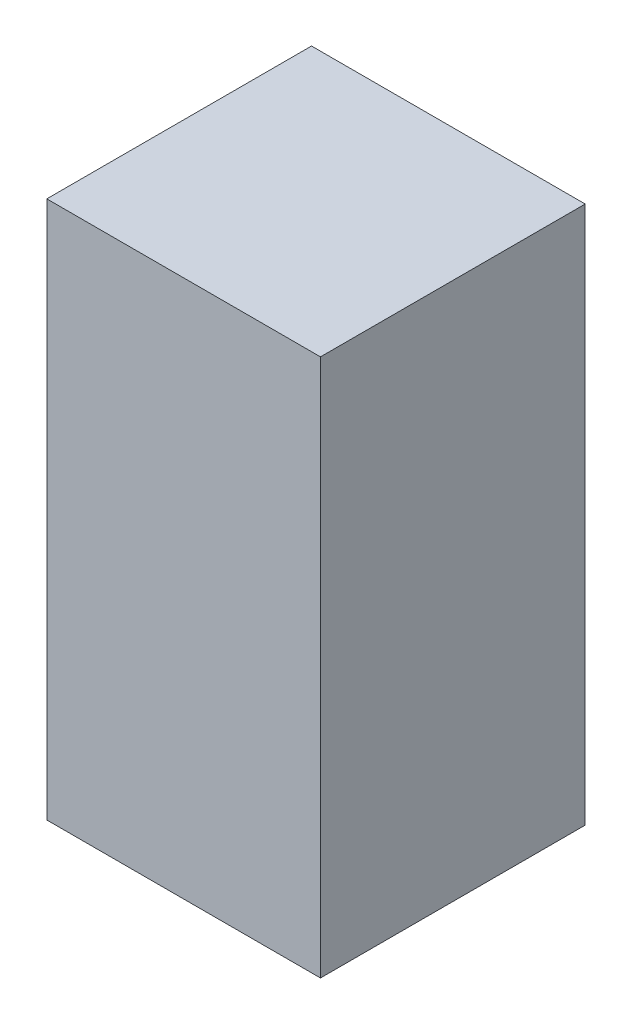
from build123d import *

# Parameters (mm, degrees)
SKETCH1_W               = 10.3378
SKETCH1_H               = 20.32
COMPONENT_OUTLINE_DEPTH = 10


with BuildPart() as part:
    # Sketch1 → Component_Outline (new body)
    with BuildSketch(Plane.XY):
        with Locations((-3.8481, 8.5598)):
            Rectangle(SKETCH1_W, SKETCH1_H)
    extrude(amount=COMPONENT_OUTLINE_DEPTH)


solid = part.part
